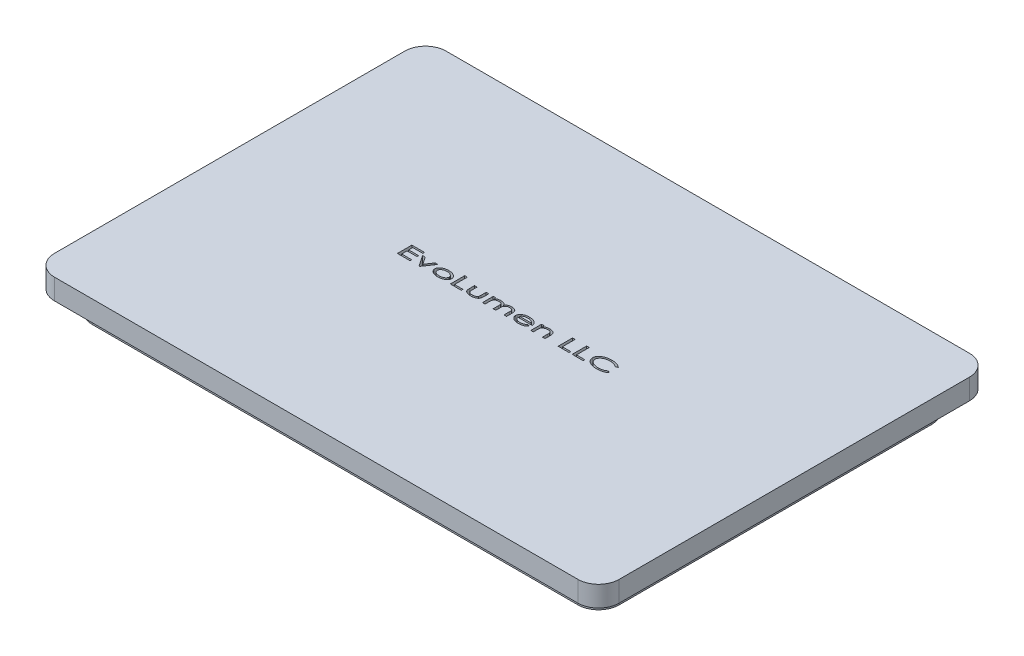
from build123d import *

# Parameters (mm, degrees)
SKETCH1_W           = 127.75
SKETCH1_H           = 85.75
BOSS_EXTRUDE1_DEPTH = 5
FILLET1_R           = 5
SKETCH2_W           = 137
SKETCH2_H           = 95
BOSS_EXTRUDE2_DEPTH = 5
FILLET2_R           = 5
CUT_EXTRUDE2_DEPTH  = 2


with BuildPart() as part:
    # Sketch1 → Boss-Extrude1 (new body)
    with BuildSketch(Plane(origin=(0, 0, 0), x_dir=(1, 0, 0), z_dir=(0, 1, 0))):
        Rectangle(SKETCH1_W, SKETCH1_H)
    extrude(amount=BOSS_EXTRUDE1_DEPTH)

    # Fillet1
    fillet1_edges = [part.edges().sort_by_distance(p)[0] for p in [
        (63.875, 2.5, 42.875),
        (-63.875, 2.5, 42.875),
        (-63.875, 2.5, -42.875),
        (63.875, 2.5, -42.875),
    ]]
    fillet(fillet1_edges, radius=FILLET1_R)

    # Sketch2 → Boss-Extrude2 (add)
    with BuildSketch(Plane(origin=(0, 5, 0), x_dir=(1, 0, 0), z_dir=(0, 1, 0))):
        Rectangle(SKETCH2_W, SKETCH2_H)
    extrude(amount=BOSS_EXTRUDE2_DEPTH)

    # Fillet2
    fillet2_edges = [part.edges().sort_by_distance(p)[0] for p in [
        (68.5, 7.5, 47.5),
        (68.5, 7.5, -47.5),
        (-68.5, 7.5, -47.5),
        (-68.5, 7.5, 47.5),
    ]]
    fillet(fillet2_edges, radius=FILLET2_R)

    # Sketch3 → Cut-Extrude2 (cut)
    # profile 1 of 11: a face of its own
    with BuildSketch(Plane(origin=(0, 10, 0), x_dir=(1, 0, 0), z_dir=(0, 1, 0))):
        Polygon((-26.879203128, 2.580019791), (-23.827921076, 2.580019791), (-23.827921076, 2.176173637), (-26.250997999, 2.176173637), (-26.250997999, 1.18899415), (-23.827921076, 1.18899415), (-23.827921076, 0.785147996), (-26.250997999, 0.785147996), (-26.250997999, -0.516134055), (-23.827921076, -0.516134055), (-23.827921076, -0.919980209), (-26.879203128, -0.919980209), align=None)
    # profile 2 of 11: a face of its own
    with BuildSketch(Plane(origin=(0, 10, 0), x_dir=(1, 0, 0), z_dir=(0, 1, 0))):
        Polygon((-23.379203128, 1.682583893), (-22.732067711, 1.682583893), (-21.521230371, -0.114391267), (-20.311094153, 1.682583893), (-19.654844153, 1.682583893), (-21.43499239, -0.919980209), (-21.608169474, -0.919980209), align=None)
    # profile 3 of 11: a face of its own
    with BuildSketch(Plane(origin=(0, 10, 0), x_dir=(1, 0, 0), z_dir=(0, 1, 0))):
        with BuildLine():
            add(Edge.make_bspline(
                [(-17.072612583, 1.727455688), (-16.997307445, 1.72642533), (-16.849680964, 1.72440544), (-16.633783529, 1.703274619), (-16.427993471, 1.670854446), (-16.232465654, 1.624589719), (-16.047200331, 1.565154175), (-15.872055357, 1.492676782), (-15.707245838, 1.406892023), (-15.605285789, 1.338581279), (-15.554683897, 1.304679246)],
                knots=[0, 0, 0, 0, 1.128443873, 2.212175709, 3.248251505, 4.249186828, 5.220763276, 6.161485273, 7.087561002, 8, 8, 8, 8], degree=3))
            add(Edge.make_bspline(
                [(-15.554683897, 1.304679246), (-15.50994051, 1.271044834), (-15.423274636, 1.205896532), (-15.306769048, 1.099501105), (-15.20948415, 0.987727744), (-15.128070485, 0.873343869), (-15.066214249, 0.753642987), (-15.020235332, 0.63106234), (-14.993730511, 0.503724908), (-14.990037428, 0.417643604), (-14.988177487, 0.374290624)],
                knots=[0, 0, 0, 0, 1.18485851, 2.295016201, 3.333121332, 4.317429539, 5.260314572, 6.177755104, 7.082265909, 8, 8, 8, 8], degree=3))
            add(Edge.make_bspline(
                [(-14.988177487, 0.374290624), (-14.989889458, 0.330671986), (-14.993292492, 0.243967433), (-15.022048899, 0.116248362), (-15.067801416, -0.007451625), (-15.132825728, -0.126889288), (-15.215485387, -0.242670413), (-15.317748889, -0.353268015), (-15.436829518, -0.46086937), (-15.572801401, -0.563108039), (-15.723215965, -0.656807882), (-15.884930396, -0.740168126), (-16.057623854, -0.80946294), (-16.24064465, -0.865982677), (-16.433840348, -0.911188379), (-16.63781013, -0.942052823), (-16.851849175, -0.961435194), (-16.998016996, -0.96369747), (-17.072612583, -0.964852004)],
                knots=[0, 0, 0, 0, 0.767380519, 1.525388846, 2.293706911, 3.0836781, 3.912807716, 4.792635664, 5.73088013, 6.735927713, 7.784258694, 8.848171135, 9.935718637, 11.056516881, 12.218570111, 13.426395823, 14.686581549, 16, 16, 16, 16], degree=3))
            add(Edge.make_bspline(
                [(-17.072612583, -0.964852004), (-17.145574863, -0.963714011), (-17.288481834, -0.96148509), (-17.497795863, -0.941875257), (-17.697267866, -0.911717633), (-17.886664857, -0.868175185), (-18.066110867, -0.812189572), (-18.235396892, -0.743395772), (-18.394905662, -0.662630258), (-18.542340658, -0.569838101), (-18.676333938, -0.469271667), (-18.793421579, -0.362561423), (-18.892853377, -0.251232662), (-18.973831459, -0.135079373), (-19.03853318, -0.014779819), (-19.083360764, 0.110952492), (-19.111081276, 0.24127112), (-19.114607544, 0.32975112), (-19.116382615, 0.374290624)],
                knots=[0, 0, 0, 0, 1.299257975, 2.544780977, 3.741050877, 4.890135248, 6.002597564, 7.085542565, 8.141068837, 9.182814716, 10.184331444, 11.121230447, 11.999953999, 12.83713516, 13.637818968, 14.425191667, 15.207265107, 16, 16, 16, 16], degree=3))
            add(Edge.make_bspline(
                [(-19.116382615, 0.374290624), (-19.11486224, 0.418362124), (-19.111842956, 0.505882899), (-19.08456323, 0.634597035), (-19.041738245, 0.758860379), (-18.981450892, 0.878466777), (-18.903408077, 0.992561421), (-18.808304189, 1.101538142), (-18.697038023, 1.206917403), (-18.61295758, 1.269984771), (-18.569507615, 1.302575881)],
                knots=[0, 0, 0, 0, 0.942102435, 1.870903806, 2.802447708, 3.748497387, 4.727775553, 5.752444922, 6.838538594, 8, 8, 8, 8], degree=3))
            add(Edge.make_bspline(
                [(-18.569507615, 1.302575881), (-18.518913893, 1.336719342), (-18.417419918, 1.40521313), (-18.253432131, 1.491197171), (-18.080225047, 1.564162211), (-17.897506773, 1.624790895), (-17.704615073, 1.670812068), (-17.502328464, 1.70313471), (-17.290648895, 1.724431848), (-17.146283736, 1.726433979), (-17.072612583, 1.727455688)],
                knots=[0, 0, 0, 0, 0.925682096, 1.856972632, 2.804192518, 3.775434969, 4.774989185, 5.809913482, 6.882374375, 8, 8, 8, 8], degree=3))
        make_face()
        with BuildLine():
            add(Edge.make_bspline(
                [(-17.074715948, 1.323609534), (-17.122185746, 1.32282092), (-17.215428478, 1.32127188), (-17.352971844, 1.308466361), (-17.485315741, 1.286819437), (-17.612804761, 1.25665813), (-17.735110865, 1.217968206), (-17.852646059, 1.171313849), (-17.964519926, 1.114427024), (-18.070721547, 1.051200143), (-18.167521591, 0.980878692), (-18.253153097, 0.906453017), (-18.326238373, 0.828072031), (-18.384791795, 0.744456761), (-18.431187702, 0.657458811), (-18.464420268, 0.56622042), (-18.484829543, 0.470548075), (-18.487052444, 0.405240411), (-18.488177487, 0.372187259)],
                knots=[0, 0, 0, 0, 1.212418829, 2.381498315, 3.52488603, 4.635511983, 5.724932766, 6.799149782, 7.86174158, 8.927548387, 9.953294562, 10.913632269, 11.822018733, 12.683278897, 13.513803279, 14.333442432, 15.156531159, 16, 16, 16, 16], degree=3))
            add(Edge.make_bspline(
                [(-18.488177487, 0.372187259), (-18.487727585, 0.350414667), (-18.486838183, 0.307372817), (-18.476996227, 0.243606121), (-18.462616473, 0.181039601), (-18.441341976, 0.119764769), (-18.413969226, 0.060200699), (-18.380433665, 0.002318097), (-18.341970536, -0.054730251), (-18.281725582, -0.128625477), (-18.193943097, -0.21451863), (-18.073417813, -0.305456479), (-17.936165127, -0.382825332), (-17.784465807, -0.447466461), (-17.620123336, -0.498165225), (-17.445915451, -0.53420131), (-17.263251124, -0.557566772), (-17.138357701, -0.559844958), (-17.074715948, -0.56100585)],
                knots=[0, 0, 0, 0, 0.558221616, 1.103538396, 1.651913144, 2.203785236, 2.764609897, 3.331398401, 3.918537603, 4.528242417, 5.774950419, 7.059478304, 8.391654116, 9.807441561, 11.283126973, 12.796815062, 14.367757892, 16, 16, 16, 16], degree=3))
            add(Edge.make_bspline(
                [(-17.074715948, -0.56100585), (-17.008736199, -0.559610763), (-16.879394678, -0.556875944), (-16.689919545, -0.532854923), (-16.509101139, -0.495565694), (-16.365282315, -0.450998836), (-16.256403496, -0.407726637), (-16.179274416, -0.3729057), (-16.106496638, -0.334708751), (-16.038110508, -0.29387562), (-15.974393953, -0.249047505), (-15.914927903, -0.201757011), (-15.860046663, -0.150958801), (-15.809671311, -0.097813381), (-15.764020441, -0.042826053), (-15.724940797, 0.013912668), (-15.691519779, 0.071273251), (-15.663812095, 0.129519305), (-15.643138322, 0.189150282), (-15.627219532, 0.249283624), (-15.617874164, 0.31042555), (-15.616880033, 0.351590283), (-15.616382615, 0.372187259)],
                knots=[0, 0, 0, 0, 2.077098916, 4.071781615, 6.004605532, 7.885543236, 8.803981816, 9.693294218, 10.549240594, 11.391148881, 12.199711323, 13.000870424, 13.782140768, 14.552659494, 15.305613219, 16.030377228, 16.719628724, 17.394585433, 18.05800703, 18.704221895, 19.351651096, 20, 20, 20, 20], degree=3))
            add(Edge.make_bspline(
                [(-15.616382615, 0.372187259), (-15.617819773, 0.404068161), (-15.620668711, 0.467266959), (-15.640885898, 0.560493826), (-15.674946112, 0.650116621), (-15.722589034, 0.736325369), (-15.783576357, 0.819079758), (-15.858678534, 0.897370736), (-15.946513901, 0.972906026), (-16.046430287, 1.043918373), (-16.155713658, 1.109240712), (-16.27142514, 1.166920543), (-16.392590197, 1.215079383), (-16.518388961, 1.255748561), (-16.650228234, 1.285115458), (-16.786846988, 1.307861852), (-16.929075179, 1.321428487), (-17.025608486, 1.322874124), (-17.074715948, 1.323609534)],
                knots=[0, 0, 0, 0, 0.799686612, 1.585251002, 2.381425143, 3.197647518, 4.049171452, 4.953478638, 5.913940052, 6.952171535, 8.025259213, 9.105756175, 10.192536624, 11.294166958, 12.419393981, 13.578211401, 14.768011817, 16, 16, 16, 16], degree=3))
        make_face(mode=Mode.SUBTRACT)
    # profile 4 of 11: a face of its own
    with BuildSketch(Plane(origin=(0, 10, 0), x_dir=(1, 0, 0), z_dir=(0, 1, 0))):
        Polygon((-14.045869794, 2.580019791), (-13.417664666, 2.580019791), (-13.417664666, -0.516134055), (-11.398433897, -0.516134055), (-11.398433897, -0.919980209), (-14.045869794, -0.919980209), align=None)
    # profile 5 of 11: a face of its own
    with BuildSketch(Plane(origin=(0, 10, 0), x_dir=(1, 0, 0), z_dir=(0, 1, 0))):
        with BuildLine():
            Line((-10.770228769, 1.682583893), (-10.14202364, 1.682583893))
            Line((-10.14202364, 1.682583893), (-10.14202364, 0.474551041))
            add(Edge.make_bspline(
                [(-10.14202364, 0.474551041), (-10.14208142, 0.440422457), (-10.14219187, 0.375182903), (-10.137767824, 0.281739741), (-10.134710024, 0.197226741), (-10.126995305, 0.1218041), (-10.119555074, 0.054903207), (-10.10772223, -0.002631147), (-10.096968524, -0.05217096), (-10.085575508, -0.080844327), (-10.080324922, -0.094058735)],
                knots=[0, 0, 0, 0, 1.424764141, 2.7235521, 3.905772858, 4.954474926, 5.888892332, 6.713753863, 7.407220581, 8, 8, 8, 8], degree=3))
            add(Edge.make_bspline(
                [(-10.080324922, -0.094058735), (-10.071404917, -0.112528828), (-10.053594557, -0.149407619), (-10.019100422, -0.200544463), (-9.980732332, -0.249368311), (-9.936246339, -0.294186501), (-9.886734462, -0.335601469), (-9.832660328, -0.37456753), (-9.772674788, -0.409225104), (-9.685607758, -0.453129052), (-9.564948786, -0.496590468), (-9.408428083, -0.534434716), (-9.237747328, -0.556774452), (-9.119387564, -0.559562123), (-9.058089346, -0.56100585)],
                knots=[0, 0, 0, 0, 0.622058078, 1.242048368, 1.868221539, 2.505514971, 3.155173548, 3.826673214, 4.526486304, 5.256414416, 6.785500448, 8.406834515, 10.139108809, 12, 12, 12, 12], degree=3))
            add(Edge.make_bspline(
                [(-9.058089346, -0.56100585), (-9.025597881, -0.560543823), (-8.961735245, -0.5596357), (-8.86788592, -0.554222906), (-8.77786438, -0.544167463), (-8.69166276, -0.531199657), (-8.609449751, -0.513743511), (-8.531383964, -0.491763553), (-8.457095264, -0.466727366), (-8.386799376, -0.438006133), (-8.32133888, -0.405914959), (-8.260887348, -0.371565567), (-8.205651227, -0.335283063), (-8.156821928, -0.295585681), (-8.111951102, -0.255158899), (-8.073186147, -0.211418656), (-8.0401977, -0.165102336), (-8.021795273, -0.132552526), (-8.012716749, -0.116494632)],
                knots=[0, 0, 0, 0, 1.310964484, 2.576727472, 3.790863264, 4.96441086, 6.092531397, 7.179224065, 8.234789577, 9.253885375, 10.240668506, 11.173969124, 12.057903498, 12.90317254, 13.710622917, 14.492109916, 15.256108166, 16, 16, 16, 16], degree=3))
            add(Edge.make_bspline(
                [(-8.012716749, -0.116494632), (-8.007033993, -0.103518766), (-7.994517474, -0.07493885), (-7.981307473, -0.025318059), (-7.969497485, 0.033688), (-7.959886446, 0.102769063), (-7.952485924, 0.181607566), (-7.946700226, 0.270447301), (-7.9444439, 0.369138385), (-7.943696833, 0.438326358), (-7.943305692, 0.474551041)],
                knots=[0, 0, 0, 0, 0.567181592, 1.249242364, 2.052178563, 2.979644943, 4.04332642, 5.22617539, 6.547711206, 8, 8, 8, 8], degree=3))
            Line((-7.943305692, 0.474551041), (-7.943305692, 1.682583893))
            Line((-7.943305692, 1.682583893), (-7.315100563, 1.682583893))
            Line((-7.315100563, 1.682583893), (-7.315100563, 0.413553445))
            add(Edge.make_bspline(
                [(-7.315100563, 0.413553445), (-7.315534979, 0.371700443), (-7.316378231, 0.290458817), (-7.325840437, 0.172509709), (-7.340197471, 0.061928593), (-7.360852551, -0.041062406), (-7.388503231, -0.136342137), (-7.421015695, -0.224034829), (-7.459801423, -0.304225009), (-7.505123158, -0.377167019), (-7.556917907, -0.444037109), (-7.614348481, -0.507110626), (-7.677952001, -0.566656412), (-7.748514256, -0.621813886), (-7.824592582, -0.674253706), (-7.907393603, -0.722131357), (-7.996183293, -0.767421907), (-8.09133769, -0.808372252), (-8.192207372, -0.845907457), (-8.299476995, -0.877051671), (-8.412187217, -0.904433231), (-8.53078669, -0.927017912), (-8.655385554, -0.943273349), (-8.785584645, -0.956304769), (-8.921770395, -0.962902666), (-9.014380576, -0.964193774), (-9.061594954, -0.964852004)],
                knots=[0, 0, 0, 0, 1.181266562, 2.2929781, 3.338027458, 4.327866484, 5.254965325, 6.136036216, 6.965185135, 7.765238556, 8.555685897, 9.349649774, 10.171204241, 11.012004536, 11.875762134, 12.777609463, 13.709998698, 14.688070359, 15.700432323, 16.746293579, 17.839228625, 18.974036285, 20.152499, 21.385386898, 22.667022029, 24, 24, 24, 24], degree=3))
            add(Edge.make_bspline(
                [(-9.061594954, -0.964852004), (-9.10764823, -0.964593528), (-9.197954234, -0.96408668), (-9.330534864, -0.955832516), (-9.45751156, -0.944024402), (-9.579085805, -0.928442857), (-9.694552915, -0.906410999), (-9.804611809, -0.880584069), (-9.908905073, -0.850038086), (-10.00733525, -0.814057623), (-10.09978274, -0.774211326), (-10.186537963, -0.730658392), (-10.267349743, -0.683191791), (-10.341772918, -0.630944621), (-10.410704619, -0.57575462), (-10.473570627, -0.516459593), (-10.530357553, -0.453412138), (-10.581709162, -0.385937614), (-10.627478032, -0.31218679), (-10.665550999, -0.229835616), (-10.697936267, -0.13920704), (-10.724094714, -0.040395399), (-10.745411182, 0.066804936), (-10.759450787, 0.182586243), (-10.768972179, 0.306823192), (-10.769801186, 0.39250019), (-10.770228769, 0.436690464)],
                knots=[0, 0, 0, 0, 1.30284483, 2.554752308, 3.756911131, 4.910966928, 6.021145498, 7.081338468, 8.108686898, 9.093973062, 10.044748313, 10.95559256, 11.839044768, 12.693895582, 13.526276734, 14.335537584, 15.136215616, 15.924454533, 16.731957383, 17.586859347, 18.486278186, 19.451930168, 20.476444233, 21.576334357, 22.749927613, 24, 24, 24, 24], degree=3))
            Line((-10.770228769, 0.436690464), (-10.770228769, 1.682583893))
        make_face()
    # profile 6 of 11: a face of its own
    with BuildSketch(Plane(origin=(0, 10, 0), x_dir=(1, 0, 0), z_dir=(0, 1, 0))):
        with BuildLine():
            Line((-6.238177487, 1.682583893), (-5.609972358, 1.682583893))
            Line((-5.609972358, 1.682583893), (-5.609972358, 1.245785015))
            add(Edge.make_bspline(
                [(-5.609972358, 1.245785015), (-5.597620465, 1.264899372), (-5.573060888, 1.302904922), (-5.531628484, 1.356406003), (-5.485674208, 1.405695111), (-5.435974083, 1.4511731), (-5.382456558, 1.492959721), (-5.324612337, 1.52981523), (-5.263450194, 1.563989949), (-5.220313273, 1.583125646), (-5.198413865, 1.592840304)],
                knots=[0, 0, 0, 0, 0.997154814, 1.982667642, 2.961128791, 3.947120579, 4.932633407, 5.932729997, 6.950504855, 8, 8, 8, 8], degree=3))
            add(Edge.make_bspline(
                [(-5.198413865, 1.592840304), (-5.133061658, 1.613658921), (-5.002593576, 1.65522087), (-4.801054632, 1.696292869), (-4.596624893, 1.722696387), (-4.459046446, 1.725865618), (-4.390020435, 1.727455688)],
                knots=[0, 0, 0, 0, 0.999294186, 1.994974634, 2.994036445, 4, 4, 4, 4], degree=3))
            add(Edge.make_bspline(
                [(-4.390020435, 1.727455688), (-4.341601806, 1.726546877), (-4.245474049, 1.724742571), (-4.10310746, 1.709257664), (-3.963515825, 1.685991413), (-3.828985296, 1.651524084), (-3.701696862, 1.61010346), (-3.584678379, 1.562279327), (-3.480651706, 1.506655545), (-3.38805321, 1.445599167), (-3.308006548, 1.376832048), (-3.241387441, 1.299618771), (-3.187300341, 1.214442211), (-3.162789896, 1.152302538), (-3.150437102, 1.120985336)],
                knots=[0, 0, 0, 0, 1.190598777, 2.36375112, 3.518592903, 4.668804318, 5.775860016, 6.809245671, 7.773624208, 8.672821562, 9.532644488, 10.360034631, 11.173488954, 12, 12, 12, 12], degree=3))
            add(Edge.make_bspline(
                [(-3.150437102, 1.120985336), (-3.13447703, 1.144650305), (-3.102546177, 1.191996122), (-3.047101454, 1.258136929), (-2.986125862, 1.320705367), (-2.918807651, 1.378882447), (-2.845242649, 1.432171044), (-2.766380371, 1.482123804), (-2.681659808, 1.52867672), (-2.590724663, 1.569172357), (-2.496521543, 1.606384568), (-2.39980141, 1.638479547), (-2.301328826, 1.666013588), (-2.201358656, 1.688253488), (-2.099608242, 1.705980268), (-1.996195601, 1.718669835), (-1.890846465, 1.725479384), (-1.820184004, 1.726794427), (-1.784651846, 1.727455688)],
                knots=[0, 0, 0, 0, 0.880711542, 1.762013967, 2.659993137, 3.575625044, 4.50499777, 5.461777002, 6.456227261, 7.486265382, 8.532674436, 9.582212962, 10.63078384, 11.68805629, 12.742567847, 13.818266804, 14.902929673, 16, 16, 16, 16], degree=3))
            add(Edge.make_bspline(
                [(-1.784651846, 1.727455688), (-1.750281562, 1.727141085), (-1.682168368, 1.726517621), (-1.581640531, 1.718856019), (-1.483750901, 1.708883721), (-1.388938523, 1.693411188), (-1.297049658, 1.672916446), (-1.208038227, 1.648604813), (-1.122026749, 1.61948712), (-1.038926999, 1.587056567), (-0.96021684, 1.549887119), (-0.886153732, 1.510140567), (-0.817863114, 1.466353619), (-0.754859366, 1.419749241), (-0.697477854, 1.369483366), (-0.645718857, 1.316033618), (-0.598210393, 1.260182511), (-0.557163409, 1.199623713), (-0.520994043, 1.134189535), (-0.489189777, 1.062589379), (-0.463799445, 0.983414753), (-0.441922362, 0.897778034), (-0.42519401, 0.804748831), (-0.413871297, 0.704733063), (-0.405536983, 0.597853518), (-0.405079764, 0.524348356), (-0.404844153, 0.486470111)],
                knots=[0, 0, 0, 0, 1.16219262, 2.303171306, 3.408265518, 4.489439645, 5.549988638, 6.591274936, 7.608614834, 8.619949041, 9.606515183, 10.550887403, 11.460858202, 12.347740474, 13.199146634, 14.037612175, 14.862441999, 15.675830131, 16.507299139, 17.38852747, 18.32088128, 19.315866155, 20.376356233, 21.514648517, 22.719263383, 24, 24, 24, 24], degree=3))
            Line((-0.404844153, 0.486470111), (-0.404844153, -0.919980209))
            Line((-0.404844153, -0.919980209), (-1.033049281, -0.919980209))
            Line((-1.033049281, -0.919980209), (-1.033049281, 0.485067868))
            add(Edge.make_bspline(
                [(-1.033049281, 0.485067868), (-1.033367731, 0.515919896), (-1.033980718, 0.575307341), (-1.037234987, 0.660445194), (-1.043419532, 0.738127467), (-1.052495748, 0.807825576), (-1.063378261, 0.869978235), (-1.077183902, 0.92422767), (-1.093859281, 0.97074352), (-1.119319639, 1.023022066), (-1.161101285, 1.080613615), (-1.22570887, 1.140479865), (-1.304478479, 1.193921345), (-1.397294734, 1.239623196), (-1.502337665, 1.277350103), (-1.61852815, 1.304376105), (-1.745168236, 1.320540939), (-1.832979323, 1.32256034), (-1.878602166, 1.323609534)],
                knots=[0, 0, 0, 0, 1.059747039, 2.039919945, 2.925891764, 3.735393082, 4.453391404, 5.092016505, 5.655770938, 6.147612892, 7.08545311, 8.079206625, 9.15910212, 10.343799353, 11.623569683, 12.984597955, 14.433327495, 16, 16, 16, 16], degree=3))
            add(Edge.make_bspline(
                [(-1.878602166, 1.323609534), (-1.93197805, 1.322231787), (-2.036945733, 1.319522343), (-2.190787171, 1.295019166), (-2.337652841, 1.254849714), (-2.454131508, 1.208678876), (-2.542060482, 1.164925335), (-2.603596347, 1.129078732), (-2.660058032, 1.089838329), (-2.712703206, 1.048104477), (-2.760700599, 1.003520467), (-2.804800688, 0.956154341), (-2.843955193, 0.905704006), (-2.879312639, 0.851384015), (-2.909971649, 0.790331939), (-2.936474919, 0.720586883), (-2.958509315, 0.641200538), (-2.976763489, 0.551956634), (-2.990370217, 0.452870134), (-2.999806644, 0.343817814), (-3.006379145, 0.225264669), (-3.007056385, 0.14293022), (-3.007408256, 0.100152002)],
                knots=[0, 0, 0, 0, 1.664064549, 3.272507839, 4.844743505, 6.40559738, 7.171746538, 7.906921901, 8.624797458, 9.314738143, 10.000816613, 10.666290716, 11.331245525, 11.990461112, 12.68489332, 13.457947973, 14.314117639, 15.252015849, 16.29742011, 17.43197759, 18.665741717, 20, 20, 20, 20], degree=3))
            Line((-3.007408256, 0.100152002), (-3.007408256, -0.919980209))
            Line((-3.007408256, -0.919980209), (-3.635613384, -0.919980209))
            Line((-3.635613384, -0.919980209), (-3.635613384, 0.400232131))
            add(Edge.make_bspline(
                [(-3.635613384, 0.400232131), (-3.635936925, 0.435289415), (-3.636556138, 0.502384155), (-3.639709067, 0.598514424), (-3.646274854, 0.68545793), (-3.653907697, 0.763760642), (-3.666209494, 0.832638631), (-3.679057731, 0.893024138), (-3.694741756, 0.944423211), (-3.720156908, 1.001045259), (-3.762068258, 1.062836568), (-3.826166935, 1.127809709), (-3.905715578, 1.185138044), (-3.999413556, 1.233871208), (-4.105243959, 1.274899326), (-4.222686508, 1.302886768), (-4.349965306, 1.320886116), (-4.438332143, 1.322682012), (-4.483970756, 1.323609534)],
                knots=[0, 0, 0, 0, 1.140822192, 2.18337416, 3.128850586, 3.977902494, 4.741797524, 5.404158169, 5.986211508, 6.486570713, 7.418834242, 8.397581847, 9.442571758, 10.595822371, 11.825945178, 13.126277941, 14.515815518, 16, 16, 16, 16], degree=3))
            add(Edge.make_bspline(
                [(-4.483970756, 1.323609534), (-4.535243786, 1.32218037), (-4.636454427, 1.319359263), (-4.785707373, 1.29526602), (-4.930051775, 1.256788767), (-5.045650769, 1.211892291), (-5.133517136, 1.168955162), (-5.195615971, 1.134015687), (-5.252766774, 1.095445274), (-5.306115444, 1.054432699), (-5.354847642, 1.01057337), (-5.399595165, 0.963686656), (-5.440234881, 0.914215746), (-5.476540277, 0.860827596), (-5.508986504, 0.80223463), (-5.535740677, 0.736171333), (-5.559068882, 0.662593673), (-5.577635971, 0.581183403), (-5.592230364, 0.491961784), (-5.602554059, 0.394823447), (-5.608853479, 0.290006319), (-5.60959166, 0.217482285), (-5.609972358, 0.180079887)],
                knots=[0, 0, 0, 0, 1.669979948, 3.296464829, 4.912933873, 6.53089132, 7.327906719, 8.098729922, 8.850699082, 9.572763068, 10.289991211, 10.984874896, 11.68308938, 12.373828967, 13.086188438, 13.861251398, 14.692220153, 15.599277331, 16.579627547, 17.636809115, 18.781245297, 20, 20, 20, 20], degree=3))
            Line((-5.609972358, 0.180079887), (-5.609972358, -0.919980209))
            Line((-5.609972358, -0.919980209), (-6.238177487, -0.919980209))
            Line((-6.238177487, -0.919980209), (-6.238177487, 1.682583893))
        make_face()
    # profile 7 of 11: a face of its own
    with BuildSketch(Plane(origin=(0, 10, 0), x_dir=(1, 0, 0), z_dir=(0, 1, 0))):
        with BuildLine():
            Line((3.884618988, -0.022544312), (4.396437898, -0.196422517))
            add(Edge.make_bspline(
                [(4.396437898, -0.196422517), (4.359885013, -0.241801626), (4.288165647, -0.33083867), (4.167671233, -0.44993463), (4.040210053, -0.554516066), (3.903253719, -0.642385252), (3.758985545, -0.717613477), (3.607127093, -0.782601695), (3.44730743, -0.839086979), (3.278642644, -0.885357017), (3.099852342, -0.92104231), (2.910672704, -0.946688379), (2.710039795, -0.962393025), (2.572615936, -0.964017394), (2.502006808, -0.964852004)],
                knots=[0, 0, 0, 0, 0.987733366, 1.938003243, 2.86793748, 3.779489496, 4.692686456, 5.624958307, 6.579090146, 7.565828611, 8.588956892, 9.669306108, 10.802476766, 12, 12, 12, 12], degree=3))
            add(Edge.make_bspline(
                [(2.502006808, -0.964852004), (2.425779664, -0.963687015), (2.277285581, -0.96141756), (2.061032775, -0.942498733), (1.857427257, -0.910385431), (1.666439143, -0.865571005), (1.487358143, -0.809245586), (1.320998068, -0.739066174), (1.167618277, -0.655322288), (1.027736837, -0.56026156), (0.903135798, -0.456888387), (0.793289441, -0.349599135), (0.701050087, -0.237838477), (0.624958761, -0.122620541), (0.565327362, -0.003949733), (0.523818086, 0.119028211), (0.497317875, 0.245318048), (0.494172283, 0.331158897), (0.492591744, 0.374290624)],
                knots=[0, 0, 0, 0, 1.369534299, 2.667917595, 3.896829062, 5.070266057, 6.189844218, 7.266208649, 8.309197482, 9.324868263, 10.300229457, 11.214836937, 12.07997973, 12.898792312, 13.691327479, 14.458915364, 15.225664211, 16, 16, 16, 16], degree=3))
            add(Edge.make_bspline(
                [(0.492591744, 0.374290624), (0.49386915, 0.414818543), (0.496405881, 0.495300779), (0.518973544, 0.61408714), (0.555969956, 0.729201257), (0.606397994, 0.841334562), (0.672860423, 0.949104349), (0.752217505, 1.054007349), (0.847064907, 1.154898466), (0.918522584, 1.216735684), (0.955332129, 1.248589502)],
                knots=[0, 0, 0, 0, 0.949540635, 1.885642194, 2.82315398, 3.779563105, 4.760658715, 5.78534503, 6.859178669, 8, 8, 8, 8], degree=3))
            add(Edge.make_bspline(
                [(0.955332129, 1.248589502), (1.00480922, 1.287083133), (1.104374433, 1.364545783), (1.269039253, 1.461442586), (1.445205468, 1.543785831), (1.633299371, 1.61100838), (1.833109873, 1.663733605), (2.04518942, 1.70028363), (2.269199667, 1.72315482), (2.422723141, 1.725999573), (2.501305687, 1.727455688)],
                knots=[0, 0, 0, 0, 0.910325136, 1.831892584, 2.76946507, 3.733227838, 4.730965353, 5.769104106, 6.858093343, 8, 8, 8, 8], degree=3))
            add(Edge.make_bspline(
                [(2.501305687, 1.727455688), (2.584323849, 1.726029281), (2.746257132, 1.723246963), (2.982563128, 1.700040255), (3.205369019, 1.660708511), (3.415383723, 1.607348227), (3.611842911, 1.537035935), (3.795268597, 1.451109999), (3.966037913, 1.350160207), (4.069111829, 1.269590211), (4.120195911, 1.229659214)],
                knots=[0, 0, 0, 0, 1.152505916, 2.248051048, 3.2926238, 4.291374431, 5.253108625, 6.185055761, 7.100502212, 8, 8, 8, 8], degree=3))
            add(Edge.make_bspline(
                [(4.120195911, 1.229659214), (4.155936909, 1.19835486), (4.225940285, 1.137041226), (4.317608206, 1.034446845), (4.395405138, 0.92580656), (4.459546722, 0.810789902), (4.510626898, 0.689871581), (4.546047662, 0.562334398), (4.56919037, 0.429093691), (4.57318974, 0.337928142), (4.575223956, 0.291558252)],
                knots=[0, 0, 0, 0, 1.057037533, 2.070344971, 3.055074535, 4.026433666, 4.996649348, 5.970110584, 6.967529411, 8, 8, 8, 8], degree=3))
            Line((4.575223956, 0.291558252), (1.120796872, 0.291558252))
            add(Edge.make_bspline(
                [(1.120796872, 0.291558252), (1.122738592, 0.262231051), (1.126589248, 0.204071816), (1.147596993, 0.118996419), (1.180612201, 0.03789002), (1.223176066, -0.040715572), (1.279149249, -0.114799525), (1.345798115, -0.18569882), (1.424709845, -0.252267206), (1.513104997, -0.315690054), (1.610345022, -0.37342002), (1.714835673, -0.423036392), (1.824384625, -0.46598765), (1.939642616, -0.501255168), (2.060774534, -0.527337138), (2.18711032, -0.547374878), (2.319289622, -0.558290829), (2.409206921, -0.560089295), (2.455031648, -0.56100585)],
                knots=[0, 0, 0, 0, 0.810065695, 1.606454041, 2.405450766, 3.222498483, 4.066280912, 4.960744433, 5.903233708, 6.91109799, 7.961005267, 9.0199109, 10.100445755, 11.206463981, 12.342769342, 13.517890192, 14.735037557, 16, 16, 16, 16], degree=3))
            add(Edge.make_bspline(
                [(2.455031648, -0.56100585), (2.502029731, -0.560392635), (2.595693972, -0.559170536), (2.734704415, -0.547502408), (2.871592664, -0.529244319), (3.00479487, -0.504356393), (3.131932026, -0.473299404), (3.250052215, -0.436688351), (3.358344989, -0.396510287), (3.459493693, -0.349519387), (3.559129852, -0.291366951), (3.661602093, -0.216446149), (3.772724014, -0.127078511), (3.846040842, -0.058584676), (3.884618988, -0.022544312)],
                knots=[0, 0, 0, 0, 1.075888473, 2.144178495, 3.191558504, 4.236858748, 5.245267633, 6.186317824, 7.066882376, 7.887981216, 8.736907243, 9.703563404, 10.791651659, 12, 12, 12, 12], degree=3))
        make_face()
        with BuildLine():
            add(Edge.make_bspline(
                [(3.947719949, 0.695404406), (3.930878618, 0.723918302), (3.896677462, 0.781823952), (3.831390083, 0.861492822), (3.757144651, 0.938669336), (3.669818484, 1.010462552), (3.569535949, 1.077737849), (3.453285747, 1.137994601), (3.321286215, 1.191523935), (3.175340796, 1.237555071), (3.019876124, 1.275756142), (2.858550602, 1.304020551), (2.693279586, 1.320205473), (2.581968936, 1.322468495), (2.525844949, 1.323609534)],
                knots=[0, 0, 0, 0, 0.732203451, 1.486949253, 2.273653048, 3.100445364, 3.98445117, 4.942619731, 5.993803213, 7.134353635, 8.327806872, 9.535742415, 10.757495725, 12, 12, 12, 12], degree=3))
            add(Edge.make_bspline(
                [(2.525844949, 1.323609534), (2.481416329, 1.322972732), (2.393601319, 1.321714065), (2.26422153, 1.310642084), (2.138802408, 1.294497622), (2.018166436, 1.269397649), (1.901563743, 1.239070817), (1.789536053, 1.200657767), (1.681376015, 1.156508684), (1.612726748, 1.120594402), (1.578629404, 1.102756169)],
                knots=[0, 0, 0, 0, 1.084691688, 2.14393809, 3.168963346, 4.170671445, 5.150735581, 6.109040763, 7.060781141, 8, 8, 8, 8], degree=3))
            add(Edge.make_bspline(
                [(1.578629404, 1.102756169), (1.536411338, 1.077560011), (1.452565238, 1.027519833), (1.342309862, 0.93127732), (1.245666465, 0.821222012), (1.1953095, 0.737626503), (1.169875398, 0.695404406)],
                knots=[0, 0, 0, 0, 1.007299645, 2.000521429, 2.990111082, 4, 4, 4, 4], degree=3))
            Line((1.169875398, 0.695404406), (3.947719949, 0.695404406))
        make_face(mode=Mode.SUBTRACT)
    # profile 8 of 11: a face of its own
    with BuildSketch(Plane(origin=(0, 10, 0), x_dir=(1, 0, 0), z_dir=(0, 1, 0))):
        with BuildLine():
            Line((5.473360975, 1.682583893), (6.101566103, 1.682583893))
            Line((6.101566103, 1.682583893), (6.101566103, 1.229659214))
            add(Edge.make_bspline(
                [(6.101566103, 1.229659214), (6.117312371, 1.250539441), (6.148897814, 1.292423093), (6.203448851, 1.349880335), (6.263210919, 1.403390792), (6.328728464, 1.452520219), (6.399910924, 1.497693427), (6.47705408, 1.537927568), (6.5595871, 1.574823652), (6.677982974, 1.617283149), (6.833743433, 1.661705185), (7.028068734, 1.700330945), (7.230301457, 1.722967552), (7.367501612, 1.725943715), (7.437203122, 1.727455688)],
                knots=[0, 0, 0, 0, 0.637214384, 1.278188477, 1.927917253, 2.591197927, 3.272541528, 3.98114723, 4.710727267, 5.475061733, 7.045979226, 8.655216041, 10.300756335, 12, 12, 12, 12], degree=3))
            add(Edge.make_bspline(
                [(7.437203122, 1.727455688), (7.474378952, 1.727195691), (7.547646872, 1.726683277), (7.65615355, 1.718289975), (7.761646374, 1.706562134), (7.864305941, 1.69086143), (7.96347263, 1.668855323), (8.059540071, 1.642056269), (8.153100983, 1.61145188), (8.242996499, 1.575573353), (8.328952358, 1.536883485), (8.409135831, 1.494129333), (8.482918943, 1.447608348), (8.55110334, 1.398487168), (8.613926525, 1.346772297), (8.670047626, 1.291228141), (8.720256276, 1.232615843), (8.764970844, 1.170444444), (8.804332816, 1.102536237), (8.837988429, 1.027146678), (8.865596566, 0.943372013), (8.888594958, 0.851968302), (8.906936501, 0.752706819), (8.919035919, 0.645166959), (8.926869045, 0.529588061), (8.92793799, 0.449791745), (8.92848918, 0.408645592)],
                knots=[0, 0, 0, 0, 1.171555776, 2.308958733, 3.428397961, 4.517239245, 5.580790075, 6.62816927, 7.660201802, 8.682114181, 9.677745142, 10.630251155, 11.543903222, 12.425141182, 13.277833467, 14.106117464, 14.910770727, 15.70807231, 16.51676232, 17.380709669, 18.305579131, 19.293659033, 20.349913169, 21.48483219, 22.703079496, 24, 24, 24, 24], degree=3))
            Line((8.92848918, 0.408645592), (8.92848918, -0.919980209))
            Line((8.92848918, -0.919980209), (8.300284052, -0.919980209))
            Line((8.300284052, -0.919980209), (8.300284052, 0.304879566))
            add(Edge.make_bspline(
                [(8.300284052, 0.304879566), (8.300161422, 0.338300944), (8.299926426, 0.402346386), (8.297839057, 0.493974856), (8.294458081, 0.576732685), (8.289603311, 0.650610296), (8.283534514, 0.715651828), (8.27580431, 0.772010209), (8.26735144, 0.819713475), (8.259126537, 0.84806562), (8.255412257, 0.86086915)],
                knots=[0, 0, 0, 0, 1.433970771, 2.747920623, 3.932230034, 4.987457052, 5.924373287, 6.734122889, 7.428343266, 8, 8, 8, 8], degree=3))
            add(Edge.make_bspline(
                [(8.255412257, 0.86086915), (8.249175897, 0.879441054), (8.236880128, 0.916057902), (8.213185669, 0.968792672), (8.182455347, 1.016775338), (8.148227113, 1.062517402), (8.107577384, 1.103401659), (8.063586605, 1.142992829), (8.012669719, 1.176565049), (7.957758514, 1.207797766), (7.89786736, 1.23505662), (7.833155037, 1.258801689), (7.763878064, 1.279225518), (7.689690372, 1.294883562), (7.611428602, 1.308522355), (7.528298446, 1.317508394), (7.440527628, 1.322096395), (7.380417137, 1.323096294), (7.349562898, 1.323609534)],
                knots=[0, 0, 0, 0, 0.858946417, 1.693521024, 2.526710235, 3.352746931, 4.193465114, 5.050514251, 5.943039889, 6.860801932, 7.819203784, 8.824352782, 9.881546406, 10.98310877, 12.147293537, 13.363884634, 14.64690287, 16, 16, 16, 16], degree=3))
            add(Edge.make_bspline(
                [(7.349562898, 1.323609534), (7.315423798, 1.323091505), (7.24820797, 1.322071568), (7.14847622, 1.313339276), (7.051609506, 1.29934183), (6.956866373, 1.280614027), (6.865263403, 1.255467271), (6.776396911, 1.223887178), (6.689386169, 1.188979617), (6.606472249, 1.146496984), (6.5278742, 1.100896783), (6.455154372, 1.051861976), (6.389873766, 0.999156838), (6.331101377, 0.943476077), (6.279021577, 0.884336349), (6.233280894, 0.822189962), (6.195031352, 0.756438459), (6.174769259, 0.710563981), (6.164667065, 0.687692066)],
                knots=[0, 0, 0, 0, 1.152624525, 2.269380619, 3.377627544, 4.456372107, 5.528514885, 6.581757474, 7.63986713, 8.691600796, 9.724332141, 10.707129468, 11.649984481, 12.554267617, 13.4377182, 14.307456724, 15.156138521, 16, 16, 16, 16], degree=3))
            add(Edge.make_bspline(
                [(6.164667065, 0.687692066), (6.159455787, 0.672351317), (6.148001249, 0.638631914), (6.136478954, 0.581587955), (6.124777288, 0.515068704), (6.117181717, 0.438174292), (6.109845348, 0.351256467), (6.105522587, 0.253959233), (6.10148346, 0.146458868), (6.101537715, 0.071410946), (6.101566103, 0.032143188)],
                knots=[0, 0, 0, 0, 0.587639498, 1.291648306, 2.109027364, 3.039425138, 4.094918437, 5.275758096, 6.574579188, 8, 8, 8, 8], degree=3))
            Line((6.101566103, 0.032143188), (6.101566103, -0.919980209))
            Line((6.101566103, -0.919980209), (5.473360975, -0.919980209))
            Line((5.473360975, -0.919980209), (5.473360975, 1.682583893))
        make_face()
    # profile 9 of 11: a face of its own
    with BuildSketch(Plane(origin=(0, 10, 0), x_dir=(1, 0, 0), z_dir=(0, 1, 0))):
        Polygon((12.114386616, 2.580019791), (12.742591744, 2.580019791), (12.742591744, -0.516134055), (14.761822513, -0.516134055), (14.761822513, -0.919980209), (12.114386616, -0.919980209), align=None)
    # profile 10 of 11: a face of its own
    with BuildSketch(Plane(origin=(0, 10, 0), x_dir=(1, 0, 0), z_dir=(0, 1, 0))):
        Polygon((15.524643026, 2.580019791), (16.152848154, 2.580019791), (16.152848154, -0.516134055), (18.172078924, -0.516134055), (18.172078924, -0.919980209), (15.524643026, -0.919980209), align=None)
    # profile 11 of 11: a face of its own
    with BuildSketch(Plane(origin=(0, 10, 0), x_dir=(1, 0, 0), z_dir=(0, 1, 0))):
        with BuildLine():
            Line((23.870796872, 1.925873156), (23.375804885, 1.682583893))
            add(Edge.make_bspline(
                [(23.375804885, 1.682583893), (23.345187049, 1.706498444), (23.28411418, 1.754200384), (23.188376046, 1.820189501), (23.089233045, 1.881216), (22.986749686, 1.938037053), (22.881092183, 1.990642641), (22.771938371, 2.038289247), (22.65981186, 2.0820267), (22.544020343, 2.120168537), (22.425374919, 2.154955697), (22.303560612, 2.183931645), (22.179179303, 2.209298102), (22.052008835, 2.230503491), (21.921710944, 2.246570975), (21.788606598, 2.25742581), (21.6527679, 2.264954379), (21.561312217, 2.265593683), (21.515027642, 2.265917227)],
                knots=[0, 0, 0, 0, 0.937710175, 1.87043426, 2.805169594, 3.747147037, 4.698354745, 5.653286244, 6.621376592, 7.602627733, 8.595359658, 9.605225631, 10.624269183, 11.659366046, 12.716732802, 13.792468381, 14.882795902, 16, 16, 16, 16], degree=3))
            add(Edge.make_bspline(
                [(21.515027642, 2.265917227), (21.465699666, 2.265450571), (21.367658932, 2.264523081), (21.222193123, 2.254896546), (21.079436107, 2.240573638), (20.939617423, 2.219196343), (20.802499001, 2.192773227), (20.66812333, 2.160557669), (20.536839294, 2.121969122), (20.409181631, 2.077221209), (20.286628333, 2.027775138), (20.170011326, 1.974565177), (20.061051393, 1.916132919), (19.957977072, 1.855041367), (19.863504768, 1.78757682), (19.774366629, 1.718153834), (19.694047233, 1.642329358), (19.619377567, 1.564449663), (19.553388396, 1.482395739), (19.496315545, 1.397136966), (19.447732969, 1.309189131), (19.407276493, 1.218354296), (19.376511828, 1.124325433), (19.35483255, 1.027349719), (19.340950234, 0.927879356), (19.339483622, 0.860447434), (19.33874559, 0.826514182)],
                knots=[0, 0, 0, 0, 1.230866572, 2.446381821, 3.636686114, 4.810457102, 5.974902542, 7.120751231, 8.257613902, 9.388340934, 10.495230428, 11.554762354, 12.58538984, 13.579646028, 14.54244086, 15.480648724, 16.396806512, 17.296213841, 18.171566182, 19.020822746, 19.853576324, 20.676136897, 21.498738824, 22.317984278, 23.153572058, 24, 24, 24, 24], degree=3))
            add(Edge.make_bspline(
                [(19.33874559, 0.826514182), (19.338998799, 0.800780315), (19.339499517, 0.749891839), (19.348068162, 0.674583887), (19.35922556, 0.600826775), (19.377414367, 0.529138488), (19.398975216, 0.458774664), (19.425379542, 0.38985544), (19.458249248, 0.323340225), (19.49437168, 0.25788243), (19.536160101, 0.194602718), (19.582537735, 0.132810878), (19.633676132, 0.07251429), (19.689875252, 0.014195814), (19.751481671, -0.041861414), (19.817030839, -0.097358968), (19.88803936, -0.150609033), (19.989545053, -0.218946819), (20.124734351, -0.298284881), (20.297259667, -0.381012606), (20.480532638, -0.45053237), (20.673845002, -0.506861941), (20.877244563, -0.55229234), (21.091258971, -0.582989031), (21.31554532, -0.602486251), (21.468477872, -0.60473119), (21.546578122, -0.605877645)],
                knots=[0, 0, 0, 0, 0.635260976, 1.256222537, 1.870275916, 2.476545955, 3.080944105, 3.687736139, 4.297076752, 4.912187559, 5.533444235, 6.168469088, 6.819687894, 7.485181962, 8.167490328, 8.876342224, 9.606044424, 10.35859045, 11.898194971, 13.473269905, 15.079365252, 16.734361295, 18.443165198, 20.222977067, 22.071133739, 24, 24, 24, 24], degree=3))
            add(Edge.make_bspline(
                [(21.546578122, -0.605877645), (21.59099342, -0.605547443), (21.679179725, -0.604891828), (21.810110839, -0.597394472), (21.938562922, -0.586619878), (22.06430983, -0.570095411), (22.187684756, -0.550208105), (22.30847628, -0.524542852), (22.427001494, -0.495518219), (22.542648628, -0.460868617), (22.655998382, -0.422427956), (22.766510103, -0.378811894), (22.874825019, -0.331368077), (22.979991279, -0.278298116), (23.083311116, -0.221913034), (23.18344779, -0.159659841), (23.282034323, -0.094279248), (23.344967529, -0.046492341), (23.376506007, -0.022544312)],
                knots=[0, 0, 0, 0, 1.089149481, 2.1624997, 3.215393273, 4.249793572, 5.272166573, 6.279372805, 7.277486841, 8.264030405, 9.23918627, 10.212014831, 11.176908998, 12.138136137, 13.10013195, 14.062520403, 15.029047449, 16, 16, 16, 16], degree=3))
            Line((23.376506007, -0.022544312), (23.870796872, -0.265132453))
            add(Edge.make_bspline(
                [(23.870796872, -0.265132453), (23.835621269, -0.295473294), (23.765042755, -0.356351043), (23.652393419, -0.440301213), (23.534544913, -0.518703404), (23.411605194, -0.592220757), (23.282283913, -0.658509529), (23.147683733, -0.719432348), (23.007604881, -0.775072779), (22.862085915, -0.824754533), (22.711466634, -0.867814949), (22.55667607, -0.905858405), (22.397673904, -0.938264273), (22.23380313, -0.963620123), (22.066046639, -0.985390836), (21.893551328, -0.99846477), (21.71706718, -1.008427647), (21.597775203, -1.009288546), (21.537463539, -1.009723799)],
                knots=[0, 0, 0, 0, 0.890146823, 1.786045867, 2.69050465, 3.602398299, 4.529999985, 5.474238902, 6.433332199, 7.417853508, 8.420189986, 9.434931611, 10.472444982, 11.529245154, 12.612690505, 13.713817493, 14.844151343, 16, 16, 16, 16], degree=3))
            add(Edge.make_bspline(
                [(21.537463539, -1.009723799), (21.481360797, -1.009486241), (21.370501755, -1.009016828), (21.206676688, -1.000286712), (21.047090974, -0.990076669), (20.892172802, -0.972544824), (20.741393245, -0.952286001), (20.595383308, -0.925112479), (20.453886072, -0.894417214), (20.316580121, -0.859714766), (20.184218376, -0.818589777), (20.055794086, -0.774142995), (19.932059511, -0.724185489), (19.812929243, -0.669313111), (19.697704751, -0.610772869), (19.587458544, -0.546547406), (19.481269271, -0.478321559), (19.41418614, -0.428192295), (19.380812898, -0.403253446)],
                knots=[0, 0, 0, 0, 1.180520581, 2.332709184, 3.451967642, 4.545336205, 5.613048088, 6.653018577, 7.669842261, 8.659966988, 9.632341244, 10.585874122, 11.519304998, 12.439252674, 13.345529918, 14.238062872, 15.123452454, 16, 16, 16, 16], degree=3))
            add(Edge.make_bspline(
                [(19.380812898, -0.403253446), (19.353462104, -0.381810613), (19.299529172, -0.339527567), (19.223742147, -0.271798796), (19.153278578, -0.202609382), (19.087170584, -0.132217541), (19.027543126, -0.059282332), (18.971485874, 0.01428387), (18.921612246, 0.090194234), (18.877567894, 0.168177097), (18.838230863, 0.247513626), (18.803511313, 0.328314596), (18.774856427, 0.411064493), (18.751685281, 0.495667157), (18.733557216, 0.581843102), (18.720049313, 0.669581334), (18.712308649, 0.759066662), (18.71113379, 0.819254896), (18.710540462, 0.849651201)],
                knots=[0, 0, 0, 0, 1.130314187, 2.228862512, 3.304065915, 4.342267514, 5.368232974, 6.367196858, 7.349797761, 8.320116595, 9.278900546, 10.229237963, 11.17893658, 12.125098813, 13.080863915, 14.042086183, 15.011212979, 16, 16, 16, 16], degree=3))
            add(Edge.make_bspline(
                [(18.710540462, 0.849651201), (18.7109321, 0.881700696), (18.71170872, 0.94525507), (18.722404782, 1.039316264), (18.7371217, 1.131589448), (18.760211905, 1.221310379), (18.787900771, 1.30968775), (18.823431607, 1.395562041), (18.863785651, 1.480329143), (18.911969108, 1.562072256), (18.965366259, 1.642689918), (19.025551977, 1.720754946), (19.092052876, 1.796831892), (19.164189941, 1.871477773), (19.243639609, 1.943170567), (19.328617646, 2.013903082), (19.420778572, 2.081303609), (19.550974243, 2.170874049), (19.724976361, 2.272803291), (19.946506474, 2.379035919), (20.180143869, 2.469532544), (20.426338193, 2.543089344), (20.684885068, 2.599795154), (20.955688618, 2.639900295), (21.239012247, 2.665040863), (21.432008065, 2.668168182), (21.530452321, 2.669763381)],
                knots=[0, 0, 0, 0, 0.62215058, 1.233728999, 1.836705992, 2.435619833, 3.031377343, 3.634080893, 4.239087745, 4.853372388, 5.475307653, 6.116299474, 6.766229859, 7.437142438, 8.13119696, 8.84375308, 9.58367465, 10.347925274, 11.91273043, 13.494320348, 15.115369153, 16.774081983, 18.480102064, 20.251945698, 22.08817403, 24, 24, 24, 24], degree=3))
            add(Edge.make_bspline(
                [(21.530452321, 2.669763381), (21.591462403, 2.66930351), (21.711917015, 2.668395569), (21.890327002, 2.658812645), (22.064303171, 2.644216432), (22.234159693, 2.62413006), (22.399476508, 2.597402282), (22.560373741, 2.565094274), (22.716994271, 2.527480926), (22.868948716, 2.483153108), (23.015840394, 2.43390062), (23.156597055, 2.378156847), (23.29127958, 2.317362588), (23.419798159, 2.250696455), (23.542045877, 2.178450882), (23.65817784, 2.100302796), (23.768238413, 2.016741821), (23.836805844, 1.955989827), (23.870796872, 1.925873156)],
                knots=[0, 0, 0, 0, 1.165761047, 2.301608025, 3.413137962, 4.501640725, 5.56919055, 6.612332177, 7.637031857, 8.646168404, 9.636179428, 10.59653408, 11.53792684, 12.458766508, 13.361792055, 14.249907282, 15.132424108, 16, 16, 16, 16], degree=3))
        make_face()
    extrude(amount=-CUT_EXTRUDE2_DEPTH, mode=Mode.SUBTRACT)


solid = part.part
